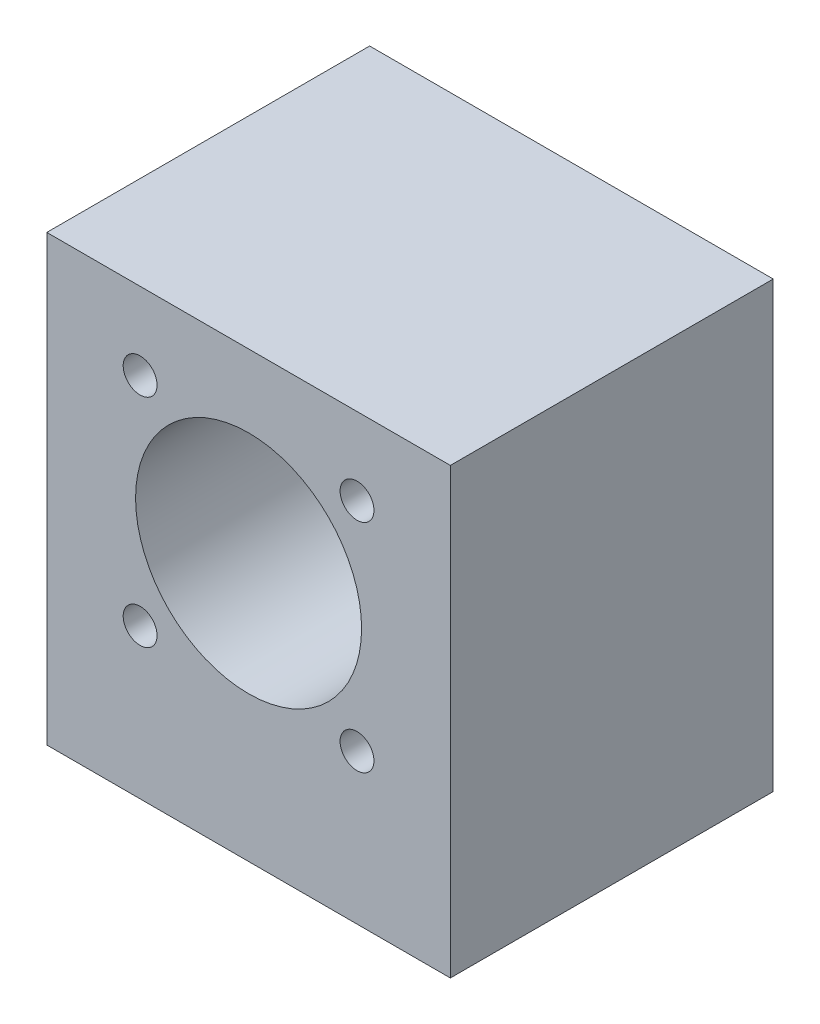
from build123d import *

# Parameters (mm, degrees)
SKETCH1_W             = 50
SKETCH1_H             = 55
BOSS_EXTRUDE1_DEPTH   = 40
SKETCH2_R             = 14
CUT_EXTRUDE1_DEPTH    = 55.60082417
M5_TAPPED_HOLE1_D     = 4.2
M5_TAPPED_HOLE1_DEPTH = 15
M5_TAPPED_HOLE1_TIP   = 1.2618073
M5_TAPPED_HOLE3_D     = 4.2
M5_TAPPED_HOLE3_DEPTH = 17.4
M5_TAPPED_HOLE3_TIP   = 1.2618073


with BuildPart() as part:
    # Sketch1 → Boss-Extrude1 (new body)
    with BuildSketch(Plane.XY):
        Rectangle(SKETCH1_W, SKETCH1_H)
    extrude(amount=-BOSS_EXTRUDE1_DEPTH)

    # Sketch2 → Cut-Extrude1 (cut, through all)
    with BuildSketch(Plane.XY):
        with Locations((0, 4.5)):
            Circle(SKETCH2_R)
    extrude(amount=-CUT_EXTRUDE1_DEPTH, mode=Mode.SUBTRACT)

    # M5 Tapped Hole1
    with Locations(Plane(origin=(-20, -27.5, -8), x_dir=(-1, 0, 0), z_dir=(0, -1, 0))):
        with Locations((0, 0), (-40, 0), (-40, 24), (0, 24)):
            Hole(M5_TAPPED_HOLE1_D / 2, depth=M5_TAPPED_HOLE1_DEPTH)
            with Locations((0, 0, -(M5_TAPPED_HOLE1_DEPTH + M5_TAPPED_HOLE1_TIP / 2))):  # 118° drill point
                Cone(0, M5_TAPPED_HOLE1_D / 2, M5_TAPPED_HOLE1_TIP, mode=Mode.SUBTRACT)

    # M5 Tapped Hole3
    with Locations(Plane(origin=(13.435028843, 17.935028843, 0), x_dir=(1, 0, 0), z_dir=(0, 0, 1))):
        with Locations((0, 0), (0, -26.870057686), (-26.870057686, -26.870057686), (-26.870057686, 0)):
            Hole(M5_TAPPED_HOLE3_D / 2, depth=M5_TAPPED_HOLE3_DEPTH)
            with Locations((0, 0, -(M5_TAPPED_HOLE3_DEPTH + M5_TAPPED_HOLE3_TIP / 2))):  # 118° drill point
                Cone(0, M5_TAPPED_HOLE3_D / 2, M5_TAPPED_HOLE3_TIP, mode=Mode.SUBTRACT)


solid = part.part
